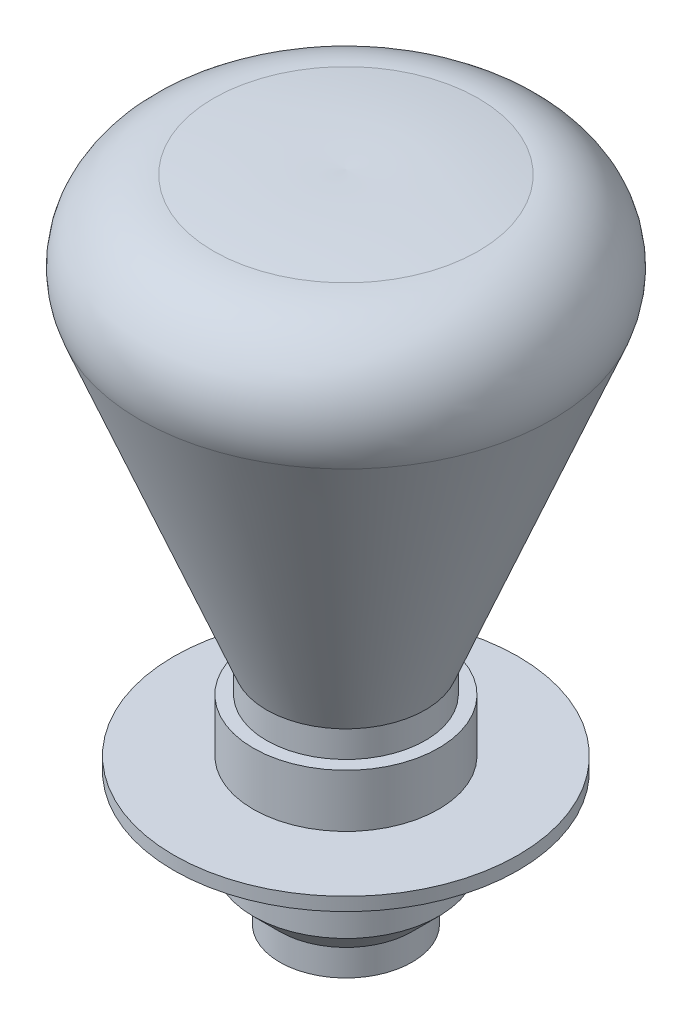
from build123d import *


with BuildPart() as part:
    # Sketch1 → Revolve1 (revolve)
    with BuildSketch(Plane.XY, mode=Mode.PRIVATE) as revolve1_sk:
        with BuildLine():
            Line((-6.282911506, 19.040573868), (-1.5, 7.161021792))
            Line((-1.5, 7.161021792), (-1.5, 6.161021792))
            Line((-1.5, 6.161021792), (-2, 6.161021792))
            Line((-2, 6.161021792), (-2, 4.161021792))
            Line((-2, 4.161021792), (-5, 4.161021792))
            Line((-5, 4.161021792), (-5, 3.661021792))
            Line((-5, 3.661021792), (-2, 3.661021792))
            Line((-2, 3.661021792), (-2, 0.661021792))
            Line((-2, 0.661021792), (-1, -0.338978208))
            Line((-1, -0.338978208), (-1, -1.338978208))
            Line((-1, -1.338978208), (1.5, -1.338978208))
            Line((1.5, -1.338978208), (1.5, 23.340167272))
            ThreePointArc((1.5, 23.340167272), (-1.004003623, 23.36233677), (-3.5, 23.161021792))
            ThreePointArc((-3.5, 23.161021792), (-5.986095711, 21.840107292), (-6.282911506, 19.040573868))
        make_face()
    revolve(revolve1_sk.sketch.rotate(Axis((1.5, 32.403614304, 0), (0, -1, 0)), 270), axis=Axis((1.5, 32.403614304, 0), (0, -1, 0)))


solid = part.part
